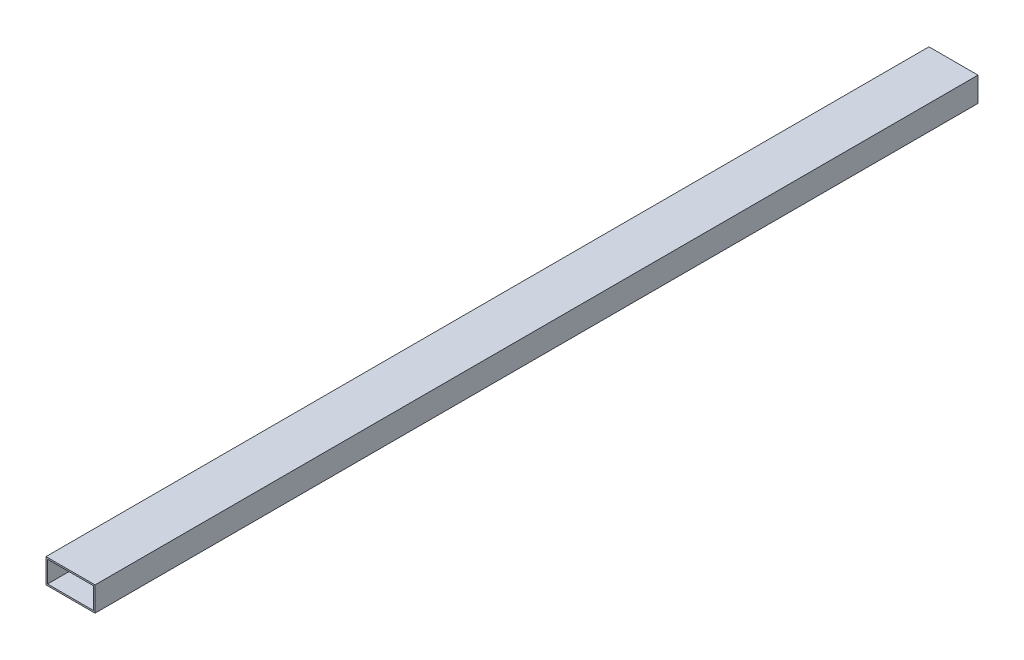
from build123d import *

# Parameters (mm, degrees)
BOSS_EXTRUDE1_DEPTH      = 457.2
BOSS_EXTRUDE1_DEPTH_BACK = 457.2
SKETCH3_W                = 50.8
SKETCH3_H                = 25.4
SKETCH3_W_2              = 47.625
SKETCH3_H_2              = 22.225


with BuildPart() as part:
    # Sketch3 → Boss-Extrude1 (new, two sides: drawn at the far end of the back side and taken through both)
    with BuildSketch(Plane.XY.offset(-BOSS_EXTRUDE1_DEPTH_BACK)):
        Rectangle(SKETCH3_W, SKETCH3_H)
        Rectangle(SKETCH3_W_2, SKETCH3_H_2, mode=Mode.SUBTRACT)
    extrude(amount=BOSS_EXTRUDE1_DEPTH + BOSS_EXTRUDE1_DEPTH_BACK)


solid = part.part
